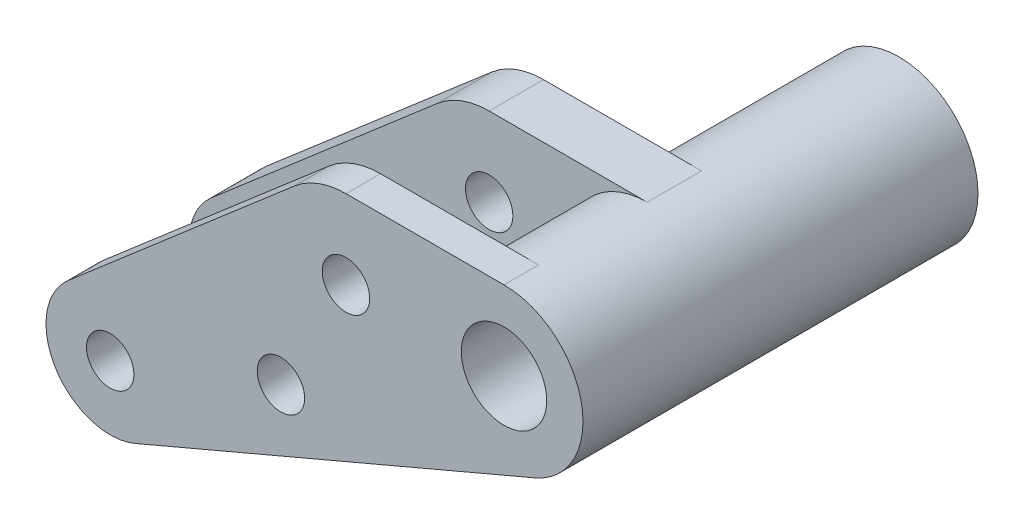
from build123d import *
from build123d.topology import SkipClean

# Parameters (mm, degrees)
SKETCH1_R           = 1.905
SKETCH1_R_2         = 3.429
BOSS_EXTRUDE1_DEPTH = 15.875
CUT_EXTRUDE2_DEPTH  = 4.365625
SKETCH6_R           = 6.35
SKETCH6_R_2         = 3.429
BOSS_EXTRUDE2_DEPTH = 15.875
SKETCH7_R           = 1.905
CUT_EXTRUDE4_DEPTH  = 45.765288281
SKETCH8_R           = 2.286
CUT_EXTRUDE5_DEPTH  = 4.365625


with BuildPart() as part:
    # Sketch1 → Boss-Extrude1 (new body)
    with BuildSketch(Plane.XY):
        with BuildLine():
            Line((-29.633029251, -19.50753994), (2.485871029, -5.843196491))
            ThreePointArc((2.485871029, -5.843196491), (6.22200923, 1.268503505), (0, 6.35))
            Line((0, 6.35), (-12.7, 6.35))
            ThreePointArc((-12.7, 6.35), (-14.910911787, 5.952677471), (-16.845147964, 4.810431203))
            Line((-16.845147964, 4.810431203), (-35.020732183, -10.851467439))
            ThreePointArc((-35.020732183, -10.851467439), (-36.033014448, -17.486271287), (-29.633029251, -19.50753994))
        make_face()
        with Locations((-12.7, 0)):
            Circle(SKETCH1_R, mode=Mode.SUBTRACT)
        with Locations((-31.652799462, -14.759942791)):
            Circle(SKETCH1_R, mode=Mode.SUBTRACT)
        Circle(SKETCH1_R_2, mode=Mode.SUBTRACT)
    extrude(amount=-BOSS_EXTRUDE1_DEPTH)

    # Sketch4 → Cut-Extrude2 (cut, symmetric)
    with SkipClean():  # the faces are left unmerged after this step: merging them gives an invalid solid
        with BuildSketch(Plane.XY.offset(-7.14375)):
            with BuildLine():
                Line((0, 6.35), (-12.7, 6.35))
                ThreePointArc((-12.7, 6.35), (-14.910911787, 5.952677471), (-16.845147964, 4.810431203))
                Line((-16.845147964, 4.810431203), (-35.020732183, -10.851467439))
                ThreePointArc((-35.020732183, -10.851467439), (-36.033014448, -17.486271287), (-29.633029251, -19.50753994))
                ThreePointArc((-29.633029251, -19.50753994), (-28.131062442, -18.530422701), (-27.053869093, -17.098529939))
                Line((-27.053869093, -17.098529939), (-20.285757113, -3.788751957))
                Line((-20.285757113, -3.788751957), (-15.073987601, -5.889540124))
                ThreePointArc((-15.073987601, -5.889540124), (-9.146995726, -5.262951703), (-6.35, 0))
                ThreePointArc((-6.35, 0), (-4.490128061, 4.490128061), (0, 6.35))
            make_face()
        extrude(amount=CUT_EXTRUDE2_DEPTH, both=True, mode=Mode.SUBTRACT)

    # Sketch6 → Boss-Extrude2 (add)
    with SkipClean():  # the faces are left unmerged after this step: merging them gives an invalid solid
        with BuildSketch(Plane(origin=(0, 0, -15.875), x_dir=(-1, 0, 0), z_dir=(0, 0, -1))):
            with Locations(Location((0, 0, 0), (0, 0, 180))):
                Circle(SKETCH6_R)
            with Locations(Location((0, 0, 0), (0, 0, 180))):
                Circle(SKETCH6_R_2, mode=Mode.SUBTRACT)
        extrude(amount=BOSS_EXTRUDE2_DEPTH)

    # Sketch7 → Cut-Extrude4 (cut, through all)
    with SkipClean():  # the faces are left unmerged after this step: merging them gives an invalid solid
        with BuildSketch(Plane(origin=(0, 0, -15.875), x_dir=(-1, 0, 0), z_dir=(0, 0, -1))):
            with Locations((17.930468191, -9.560371879)):
                Circle(SKETCH7_R)
        extrude(amount=-CUT_EXTRUDE4_DEPTH, mode=Mode.SUBTRACT)

    # Sketch8 → Cut-Extrude5 (cut)
    with SkipClean():  # the faces are left unmerged after this step: merging them gives an invalid solid
        with BuildSketch(Plane(origin=(0, 0, -15.875), x_dir=(-1, 0, 0), z_dir=(0, 0, -1))):
            with Locations((17.930468191, -9.560371879)):
                Circle(SKETCH8_R)
        extrude(amount=-CUT_EXTRUDE5_DEPTH, mode=Mode.SUBTRACT)


solid = part.part
